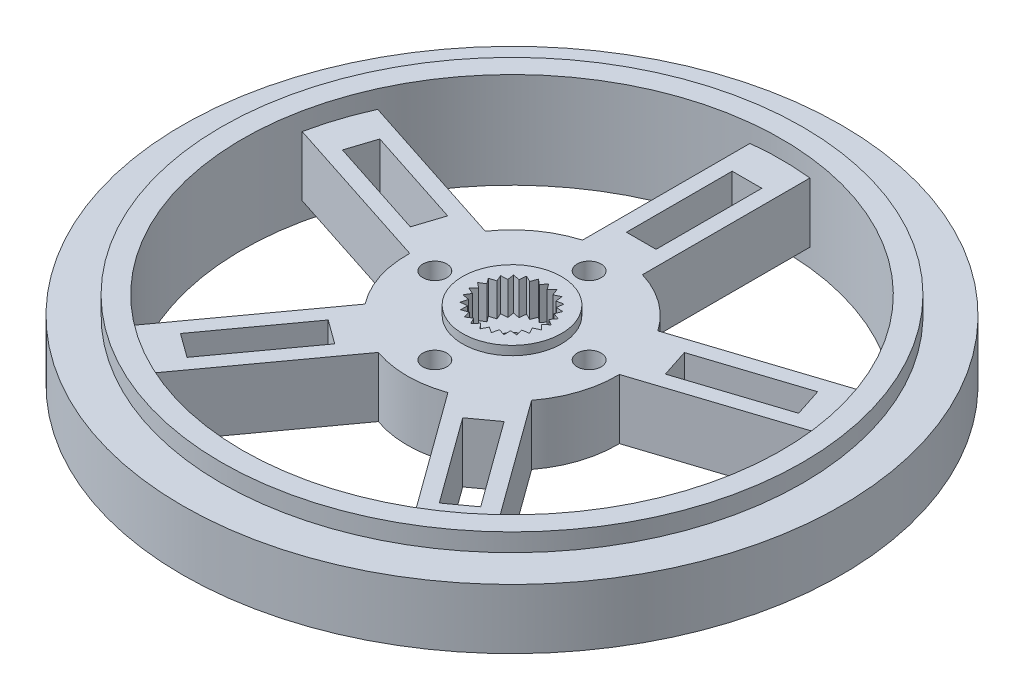
from build123d import *

# Parameters (mm, degrees)
SKETCH2_R                = 27.94
BOSS_EXTRUDE1_DEPTH      = 5.08
SKETCH3_R                = 22.86
CUT_EXTRUDE1_DEPTH       = 40.838343339
BOSS_EXTRUDE2_DEPTH      = 1.524
BOSS_EXTRUDE2_DEPTH_BACK = 6.604
SKETCH4_R                = 24.638
SKETCH4_R_2              = 22.86
SKETCH5_R                = 8.89
SKETCH5_W                = 5.08
SKETCH5_H                = 18.131594767
SKETCH5_W_2              = 2.51172526
SKETCH5_H_2              = 8.964878854
BOSS_EXTRUDE4_DEPTH      = 5.08
SKETCH6_R                = 4.191
SKETCH6_R_2              = 2.667
BOSS_EXTRUDE5_DEPTH      = 0.762
CUT_EXTRUDE2_START       = -2.794
SKETCH8_R                = 2.667
CUT_EXTRUDE2_DEPTH       = 2.794
CUT_EXTRUDE3_DEPTH       = 2.794
SKETCH10_R               = 1.1176
CUT_EXTRUDE4_DEPTH       = 40.776756831
SKETCH11_R               = 1.016
CUT_EXTRUDE5_DEPTH       = 41.061203377


with BuildPart() as part:
    # Sketch2 → Boss-Extrude1 (new body)
    with BuildSketch(Plane(origin=(0, 0, 0), x_dir=(1, 0, 0), z_dir=(0, 1, 0))):
        with Locations(Location((0, 0, 0), (0, 0, 270))):
            Circle(SKETCH2_R)
    extrude(amount=BOSS_EXTRUDE1_DEPTH)

    # Sketch3 → Cut-Extrude1 (cut, through all)
    with BuildSketch(Plane(origin=(0, 5.08, 0), x_dir=(1, 0, 0), z_dir=(0, 1, 0))):
        with Locations(Location((0, 0, 0), (0, 0, 270))):
            Circle(SKETCH3_R)
    extrude(amount=-CUT_EXTRUDE1_DEPTH, mode=Mode.SUBTRACT)

    # Sketch4 → Boss-Extrude2 (add, two sides: drawn at the far end of the back side and taken through both)
    with BuildSketch(Plane(origin=(0, 5.08, 0), x_dir=(1, 0, 0), z_dir=(0, 1, 0)).offset(-BOSS_EXTRUDE2_DEPTH_BACK)):
        with Locations(Location((0, 0, 0), (0, 0, 270))):
            Circle(SKETCH4_R)
        with Locations(Location((0, 0, 0), (0, 0, 270))):
            Circle(SKETCH4_R_2, mode=Mode.SUBTRACT)
    extrude(amount=BOSS_EXTRUDE2_DEPTH + BOSS_EXTRUDE2_DEPTH_BACK)

    # Sketch5 → Boss-Extrude4 (add)
    # profile 1 of 6: a face of its own
    with BuildSketch(Plane(origin=(0, 5.08, 0), x_dir=(1, 0, 0), z_dir=(0, 1, 0))):
        Circle(SKETCH5_R)
    # profile 2 of 6: a face of its own
    with BuildSketch(Plane(origin=(0, 5.08, 0), x_dir=(1, 0, 0), z_dir=(0, 1, 0))):
        Polygon((5.278203535, 4.385706339), (22.522374889, 9.988677257), (24.092181221, 5.157310154), (6.848009867, -0.445660764), align=None)
        Polygon((10.810222047, 2.19196195), (10.034056257, 4.580754625), (18.560162709, 7.351054544), (19.336328499, 4.962261868), align=None, mode=Mode.SUBTRACT)
    # profile 3 of 6: a face of its own
    with BuildSketch(Plane(origin=(0, 5.08, 0), x_dir=(1, 0, 0), z_dir=(0, 1, 0))):
        with Locations((0, 15.440925042)):
            Rectangle(SKETCH5_W, SKETCH5_H)
        with Locations((0, 15.440925041)):
            Rectangle(SKETCH5_W_2, SKETCH5_H_2, mode=Mode.SUBTRACT)
    # profile 4 of 6: a face of its own
    with BuildSketch(Plane(origin=(0, 5.08, 0), x_dir=(1, 0, 0), z_dir=(0, 1, 0))):
        Polygon((5.802109184, -3.664612076), (16.459593189, -18.333380377), (12.349786858, -21.319329459), (1.692302853, -6.650561157), align=None)
        Polygon((5.425222021, -9.603778627), (7.457250442, -8.127423562), (12.726674021, -15.380162907), (10.6946456, -16.856517973), align=None, mode=Mode.SUBTRACT)
    # profile 5 of 6: a face of its own
    with BuildSketch(Plane(origin=(0, 5.08, 0), x_dir=(1, 0, 0), z_dir=(0, 1, 0))):
        Polygon((-1.692302853, -6.650561157), (-12.349786858, -21.319329459), (-16.459593189, -18.333380377), (-5.802109184, -3.664612076), align=None)
        Polygon((-7.457250442, -8.127423562), (-5.425222021, -9.603778627), (-10.6946456, -16.856517973), (-12.726674021, -15.380162907), align=None, mode=Mode.SUBTRACT)
    # profile 6 of 6: a face of its own
    with BuildSketch(Plane(origin=(0, 5.08, 0), x_dir=(1, 0, 0), z_dir=(0, 1, 0))):
        Polygon((-6.848009867, -0.445660764), (-24.092181221, 5.157310154), (-22.522374889, 9.988677257), (-5.278203535, 4.385706339), align=None)
        Polygon((-10.034056257, 4.580754625), (-10.810222047, 2.19196195), (-19.336328499, 4.962261868), (-18.560162709, 7.351054544), align=None, mode=Mode.SUBTRACT)
    extrude(amount=-BOSS_EXTRUDE4_DEPTH)

    # Sketch6 → Boss-Extrude5 (add)
    with BuildSketch(Plane(origin=(0, 5.08, 0), x_dir=(1, 0, 0), z_dir=(0, 1, 0))):
        with Locations(Location((0, 0, 0), (0, 0, 90))):
            Circle(SKETCH6_R)
        with Locations(Location((0, 0, 0), (0, 0, 90))):
            Circle(SKETCH6_R_2, mode=Mode.SUBTRACT)
    extrude(amount=BOSS_EXTRUDE5_DEPTH)

    # Sketch8 → Cut-Extrude2 (cut)
    with BuildSketch(Plane(origin=(0, 5.842, 0), x_dir=(1, 0, 0), z_dir=(0, 1, 0)).offset(CUT_EXTRUDE2_START)):
        with Locations(Location((0, 0, 0), (0, 0, 90))):
            Circle(SKETCH8_R)
    extrude(amount=CUT_EXTRUDE2_DEPTH, mode=Mode.SUBTRACT)

    # Sketch9 → Cut-Extrude3 (cut)
    with BuildSketch(Plane(origin=(0, 5.842, 0), x_dir=(1, 0, 0), z_dir=(0, 1, 0))):
        Polygon((0, 3.125091392), (-0.334263734, 2.645969908), (-0.777178626, 3.026910899), (-0.981788182, 2.479713888), (-1.50552426, 2.738538463), (-1.567623268, 2.157648324), (-2.139272268, 2.278093583), (-2.054958818, 1.700009781), (-2.638601932, 1.674507705), (-2.413173749, 1.135553371), (-2.972138533, 0.965706349), (-2.619760098, 0.499745966), (-3.118924738, 0.196226112), (-2.661737285, -0.167462316), (-3.069737432, -0.585583733), (-2.536467729, -0.824148324), (-2.827667233, -1.330599199), (-2.251822577, -1.429050062), (-2.407924303, -1.992008224), (-1.825687132, -1.944159329), (-1.836882632, -2.528252045), (-1.284837049, -2.337109916), (-1.150422871, -2.905636493), (-0.663255929, -2.583211291), (-0.391677809, -3.100449113), (0, -2.667), (0.391677809, -3.100449113), (0.663255929, -2.583211291), (1.150422871, -2.905636493), (1.284837049, -2.337109916), (1.836882632, -2.528252045), (1.825687132, -1.944159329), (2.407924303, -1.992008224), (2.251822577, -1.429050062), (2.827667233, -1.330599199), (2.536467729, -0.824148324), (3.069737432, -0.585583733), (2.661737285, -0.167462316), (3.118924738, 0.196226112), (2.619760098, 0.499745966), (2.972138533, 0.965706349), (2.413173749, 1.135553371), (2.638601932, 1.674507705), (2.054958818, 1.700009781), (2.139272268, 2.278093583), (1.567623268, 2.157648324), (1.50552426, 2.738538463), (0.981788182, 2.479713888), (0.777178626, 3.026910899), (0.334263734, 2.645969908), align=None)
    extrude(amount=-CUT_EXTRUDE3_DEPTH, mode=Mode.SUBTRACT)

    # Sketch10 → Cut-Extrude4 (cut, through all)
    with BuildSketch(Plane(origin=(0, 3.048, 0), x_dir=(1, 0, 0), z_dir=(0, 1, 0))):
        with Locations(Location((0, 0, 0), (0, 0, 270))):
            Circle(SKETCH10_R)
    extrude(amount=-CUT_EXTRUDE4_DEPTH, mode=Mode.SUBTRACT)

    # Sketch11 → Cut-Extrude5 (cut, through all)
    with BuildSketch(Plane(origin=(0, 5.08, 0), x_dir=(1, 0, 0), z_dir=(0, 1, 0))):
        with Locations(Location((0, 6.5405, 0), (0, 0, 270))):
            Circle(SKETCH11_R)
        with Locations(Location((6.5405, 0, 0), (0, 0, 270))):
            Circle(SKETCH11_R)
        with Locations(Location((0, -6.5405, 0), (0, 0, 270))):
            Circle(SKETCH11_R)
        with Locations(Location((-6.5405, 0, 0), (0, 0, 270))):
            Circle(SKETCH11_R)
    extrude(amount=-CUT_EXTRUDE5_DEPTH, mode=Mode.SUBTRACT)


solid = part.part
